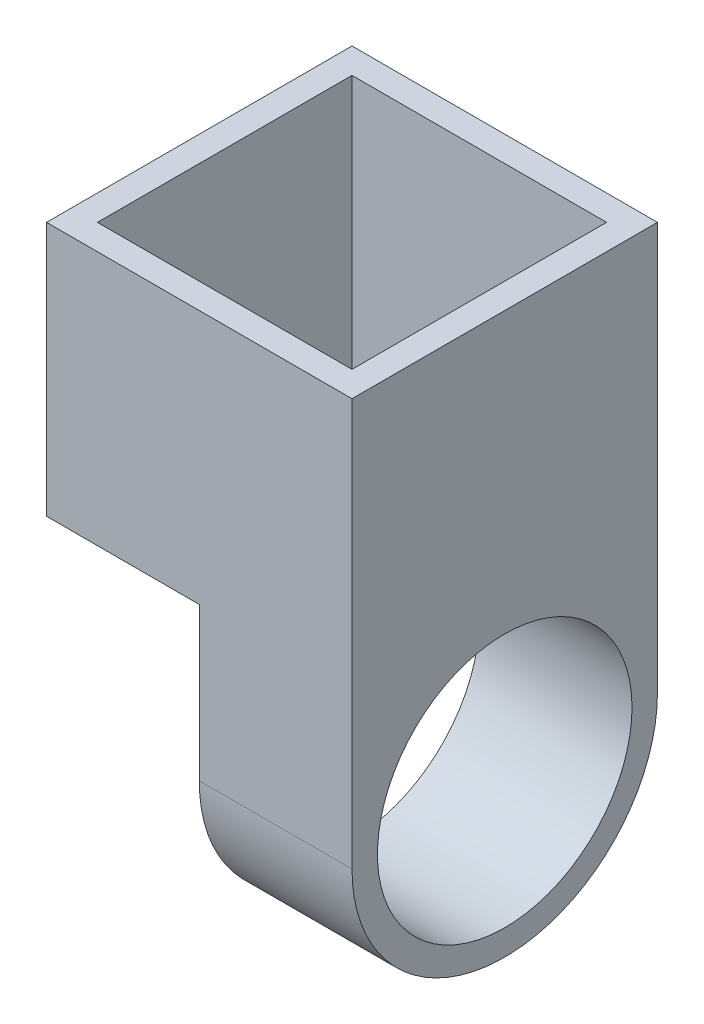
from build123d import *

# Parameters (mm, degrees)
SKETCH_1_W          = 12
SKETCH_1_H          = 12
SKETCH_1_W_2        = 10
SKETCH_1_H_2        = 10
EXTRUDE_1_DEPTH     = 10
EXTRUDE_2_DEPTH     = 6
SKETCH_4_R          = 5
CUT_EXTRUDE_1_DEPTH = 6


with BuildPart() as part:
    # 草图1 → 凸台-拉伸1 (new body)
    with BuildSketch(Plane(origin=(0, 0, 0), x_dir=(1, 0, 0), z_dir=(0, 1, 0))):
        Rectangle(SKETCH_1_W, SKETCH_1_H)
        Rectangle(SKETCH_1_W_2, SKETCH_1_H_2, mode=Mode.SUBTRACT)
    extrude(amount=EXTRUDE_1_DEPTH)

    # 草图3 → 凸台-拉伸2 (add)
    with BuildSketch(Plane(origin=(6, 0, 0), x_dir=(0, 0, -1), z_dir=(1, 0, 0))):
        Polygon((0, -6), (-6, 0), (-6, -6), align=None)
        Polygon((6, 0), (-6, 0), (0, -6), (6, -6), align=None)
        with BuildLine():
            Line((0, -6), (-6, -6))
            ThreePointArc((-6, -6), (-4.242640687, -10.242640687), (0, -12))
            ThreePointArc((0, -12), (2.296100594, -11.543277195), (4.242640687, -10.242640687))
            Line((4.242640687, -10.242640687), (0, -6))
        make_face()
        with BuildLine():
            Line((6, -6), (0, -6))
            Line((0, -6), (4.242640687, -10.242640687))
            ThreePointArc((4.242640687, -10.242640687), (5.543277195, -8.296100594), (6, -6))
        make_face()
    extrude(amount=-EXTRUDE_2_DEPTH)

    # 草图4 → 切除-拉伸1 (cut)
    with BuildSketch(Plane(origin=(6, 0, 0), x_dir=(0, 0, -1), z_dir=(1, 0, 0))):
        with Locations((0, -6)):
            Circle(SKETCH_4_R)
    extrude(amount=-CUT_EXTRUDE_1_DEPTH, mode=Mode.SUBTRACT)


solid = part.part
